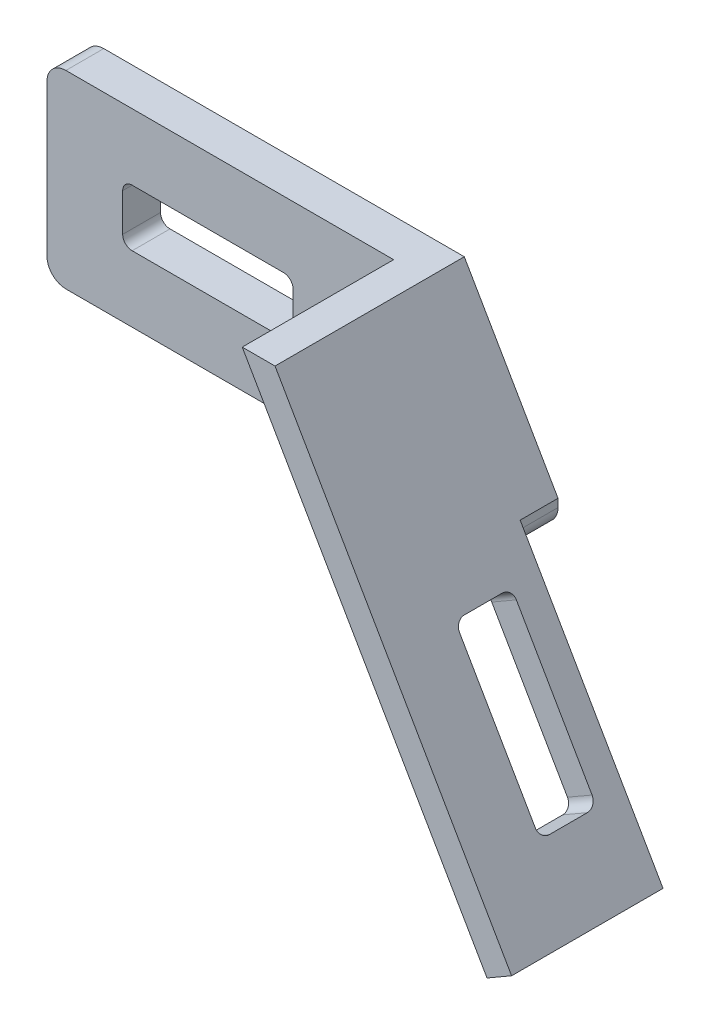
from build123d import *

# Parameters (mm, degrees)
BOSS_EXTRU_1_DEPTH      = 4
ENL_V_MAT_EXTRU_1_DEPTH = 50
BOSS_EXTRU_2_DEPTH      = 16
ENL_V_MAT_EXTRU_2_REACH = 64.735
ENL_V_MAT_EXTRU_4_DEPTH = 66.148525236


with BuildPart() as part:
    # Esquisse1 → Boss.-Extru.1 (new body)
    with BuildSketch(Plane.XY):
        with BuildLine():
            Line((-11.273273273, 8.708708709), (34.726726727, 8.708708709))
            ThreePointArc((34.726726727, 8.708708709), (36.140940289, 8.122922271), (36.726726727, 6.708708709))
            Line((36.726726727, 6.708708709), (36.726726727, -9.291291291))
            ThreePointArc((36.726726727, -9.291291291), (36.140940289, -10.705504854), (34.726726727, -11.291291291))
            Line((34.726726727, -11.291291291), (-11.273273273, -11.291291291))
            ThreePointArc((-11.273273273, -11.291291291), (-12.687486836, -10.705504854), (-13.273273273, -9.291291291))
            Line((-13.273273273, -9.291291291), (-13.273273273, 6.708708709))
            ThreePointArc((-13.273273273, 6.708708709), (-12.687486836, 8.122922271), (-11.273273273, 8.708708709))
        make_face()
    extrude(amount=BOSS_EXTRU_1_DEPTH)

    # Esquisse3 → Enlèv. mat.-Extru.1 (cut)
    with BuildSketch(Plane.XY.offset(4)):
        with BuildLine():
            Line((-4.273273273, 1.708708709), (11.726726727, 1.708708709))
            ThreePointArc((11.726726727, 1.708708709), (12.433833508, 1.41581549), (12.726726727, 0.708708709))
            Line((12.726726727, 0.708708709), (12.726726727, -3.291291291))
            ThreePointArc((12.726726727, -3.291291291), (12.433833508, -3.998398072), (11.726726727, -4.291291291))
            Line((11.726726727, -4.291291291), (-4.273273273, -4.291291291))
            ThreePointArc((-4.273273273, -4.291291291), (-4.980380054, -3.998398072), (-5.273273273, -3.291291291))
            Line((-5.273273273, -3.291291291), (-5.273273273, 0.708708709))
            ThreePointArc((-5.273273273, 0.708708709), (-4.980380054, 1.41581549), (-4.273273273, 1.708708709))
        make_face()
    extrude(amount=-ENL_V_MAT_EXTRU_1_DEPTH, mode=Mode.SUBTRACT)

    # Esquisse4 → Boss.-Extru.2 (add)
    with BuildSketch(Plane.XY.offset(4)):
        Polygon((27.400678474, 7.708708709), (51.823328204, -34.592561481), (49.225251993, -36.092561481), (23.359226589, 8.708708709), (25.668627666, 8.708708709), (26.823328204, 8.708708709), align=None)
    extrude(amount=BOSS_EXTRU_2_DEPTH)

    # Esquisse6 → Enlèv. mat.-Extru.2 (cut, up to next)
    with BuildSketch(Plane(origin=(21.29040143, 12.292018997, 0), x_dir=(0, 0, 1), z_dir=(-0.8660254037844363, -0.5000000000000042, 0)), mode=Mode.PRIVATE) as enl_v_mat_extru_2_sk1:
        with BuildLine():
            Line((8, -29.869701126), (12, -29.869701126))
            ThreePointArc((12, -29.869701126), (12.707106781, -30.162594345), (13, -30.869701126))
            Line((13, -30.869701126), (13, -46.869701126))
            ThreePointArc((13, -46.869701126), (12.707106781, -47.576807907), (12, -47.869701126))
            Line((12, -47.869701126), (8, -47.869701126))
            ThreePointArc((8, -47.869701126), (7.292893219, -47.576807907), (7, -46.869701126))
            Line((7, -46.869701126), (7, -30.869701126))
            ThreePointArc((7, -30.869701126), (7.292893219, -30.162594345), (8, -29.869701126))
        make_face()
    enl_v_mat_extru_2_tool1 = extrude(enl_v_mat_extru_2_sk1.sketch, amount=-ENL_V_MAT_EXTRU_2_REACH, mode=Mode.PRIVATE) & part.part
    add(enl_v_mat_extru_2_tool1.solids().sort_by_distance((40.725252, -21.37013, 10))[0], mode=Mode.SUBTRACT)

    # Esquisse11 → Enlèv. mat.-Extru.4 (cut, through all)
    with BuildSketch(Plane.XY.offset(4)):
        with BuildLine():
            Line((36.749431367, 6.794564493), (36.991578009, -8.903216578))
            Line((36.991578009, -8.903216578), (27.400678474, 7.708708709))
            Line((27.400678474, 7.708708709), (26.823328204, 8.708708709))
            Line((26.823328204, 8.708708709), (34.726726727, 8.708708709))
            ThreePointArc((34.726726727, 8.708708709), (36.561329958, 8.621578074), (36.749431367, 6.794564493))
        make_face()
    extrude(amount=-ENL_V_MAT_EXTRU_4_DEPTH, mode=Mode.SUBTRACT)


solid = part.part
